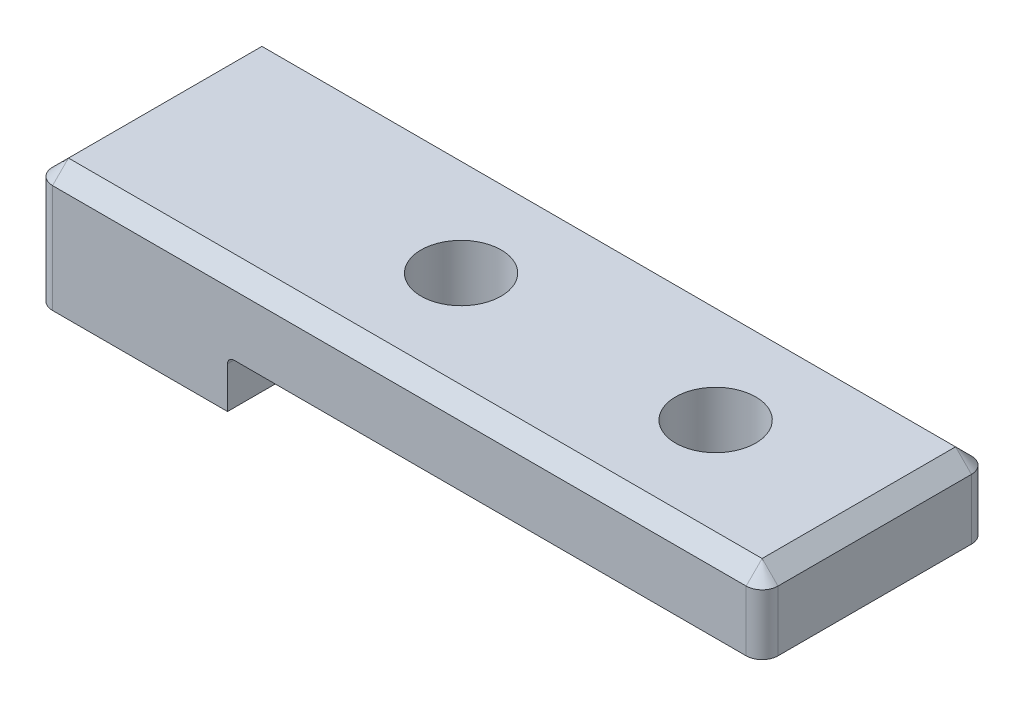
from build123d import *

# Parameters (mm, degrees)
SKETCH1_W           = 28.956
SKETCH1_H           = 8.9916
SKETCH1_R           = 1.6002
BOSS_EXTRUDE1_DEPTH = 3.048
SKETCH2_W           = 7.62
SKETCH2_H           = 1.905
BOSS_EXTRUDE2_DEPTH = 6.35
FILLET1_R           = 0.254
FILLET2_R           = 0.635
CHAMFER1_SIZE       = 0.635


with BuildPart() as part:
    # Sketch1 → Boss-Extrude1 (new body)
    with BuildSketch(Plane(origin=(0, 0, 0), x_dir=(1, 0, 0), z_dir=(0, 1, 0))):
        Rectangle(SKETCH1_W, SKETCH1_H)
        with Locations(Location((8.128, 0, 0), (0, 0, 90))):
            Circle(SKETCH1_R, mode=Mode.SUBTRACT)
        with Locations(Location((-2.032, 0, 0), (0, 0, 90))):
            Circle(SKETCH1_R, mode=Mode.SUBTRACT)
    extrude(amount=BOSS_EXTRUDE1_DEPTH)

    # Sketch2 → Boss-Extrude2 (add)
    with BuildSketch(Plane.XY.offset(4.4958)):
        with Locations((-10.668, -0.9525)):
            Rectangle(SKETCH2_W, SKETCH2_H)
    extrude(amount=-BOSS_EXTRUDE2_DEPTH)

    # Fillet1
    fillet1_edges = [part.edges().sort_by_distance(p)[0] for p in [
        (-10.668, 0, -1.8542),
        (-6.858, 0, 1.3208),
    ]]
    fillet(fillet1_edges, radius=FILLET1_R)

    # Fillet2
    fillet2_edges = [part.edges().sort_by_distance(p)[0] for p in [
        (14.478, 1.524, 4.4958),
        (-14.478, 0.5715, 4.4958),
        (-14.478, 1.524, -4.4958),
        (14.478, 1.524, -4.4958),
    ]]
    fillet(fillet2_edges, radius=FILLET2_R)

    # Chamfer1
    chamfer1_edges = [part.edges().sort_by_distance(p)[0] for p in [
        (0, 3.048, -4.4958),
        (14.478, 3.048, 0),
        (-14.478, 3.048, 0),
        (0, 3.048, 4.4958),
        (-14.292012806, 3.048, -4.309812806),
        (-14.292012806, 3.048, 4.309812806),
        (14.292012806, 3.048, 4.309812806),
        (14.292012806, 3.048, -4.309812806),
    ]]
    chamfer(chamfer1_edges, length=CHAMFER1_SIZE)


solid = part.part
